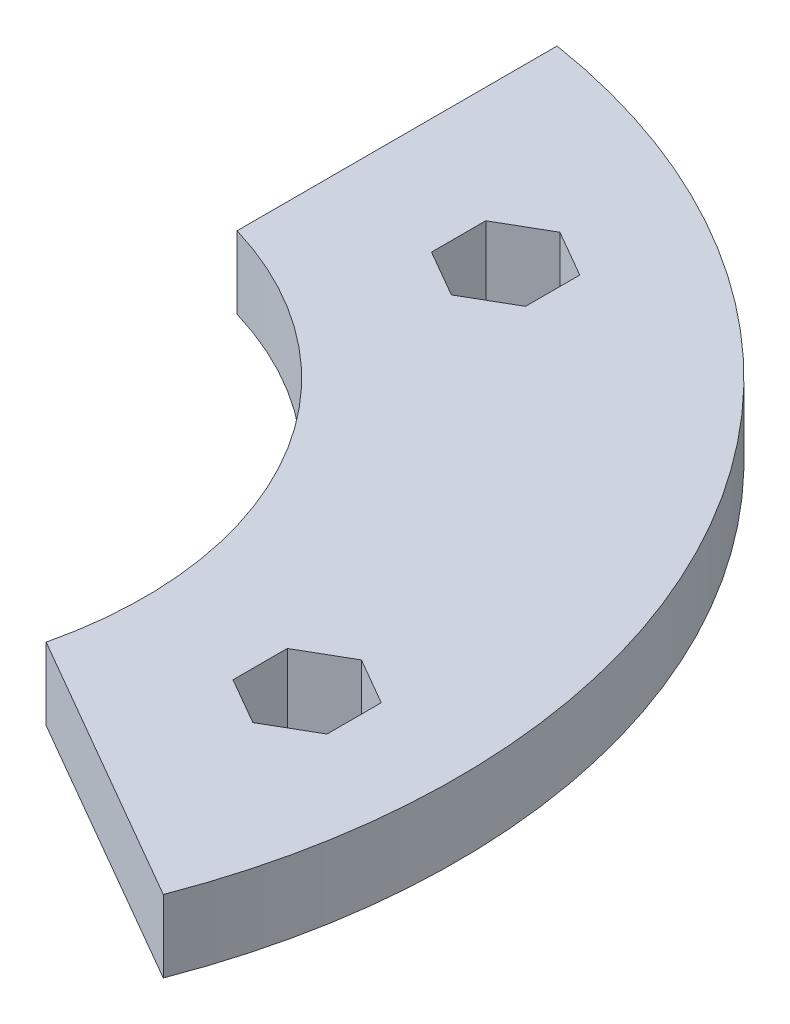
from build123d import *

# Parameters (mm, degrees)
SKETCH1_R           = 38.3
SKETCH1_R_2         = 21
BOSS_EXTRUDE1_DEPTH = 4
CUT_EXTRUDE1_DEPTH  = 10


with BuildPart() as part:
    # Sketch1 → Boss-Extrude1 (new body)
    with BuildSketch(Plane(origin=(0, 0, 0), x_dir=(1, 0, 0), z_dir=(0, 1, 0))):
        with Locations(Location((0, 0, 0), (0, 0, 270))):
            Circle(SKETCH1_R)
        with Locations(Location((0, 0, 0), (0, 0, 270))):
            Circle(SKETCH1_R_2, mode=Mode.SUBTRACT)
        Polygon((12.4, -27.481872813), (15, -28.982983513), (17.6, -27.481872813), (17.6, -24.479651414), (15, -22.978540714), (12.4, -24.479651414), align=None, mode=Mode.SUBTRACT)
        Polygon((30, 3.0022214), (27.4, 1.5011107), (27.4, -1.5011107), (30, -3.0022214), (32.6, -1.5011107), (32.6, 1.5011107), align=None, mode=Mode.SUBTRACT)
        Polygon((-17.6, -24.479651414), (-17.6, -27.481872813), (-15, -28.982983513), (-12.4, -27.481872813), (-12.4, -24.479651414), (-15, -22.978540714), align=None, mode=Mode.SUBTRACT)
        Polygon((-30, 3.0022214), (-32.6, 1.5011107), (-32.6, -1.5011107), (-30, -3.0022214), (-27.4, -1.5011107), (-27.4, 1.5011107), align=None, mode=Mode.SUBTRACT)
        Polygon((-12.4, 27.481872813), (-15, 28.982983513), (-17.6, 27.481872813), (-17.6, 24.479651414), (-15, 22.978540714), (-12.4, 24.479651414), align=None, mode=Mode.SUBTRACT)
        Polygon((17.6, 24.479651414), (17.6, 27.481872813), (15, 28.982983513), (12.4, 27.481872813), (12.4, 24.479651414), (15, 22.978540714), align=None, mode=Mode.SUBTRACT)
    extrude(amount=BOSS_EXTRUDE1_DEPTH)

    # Sketch2 → Cut-Extrude1 (cut)
    with BuildSketch(Plane(origin=(0, 4, 0), x_dir=(1, 0, 0), z_dir=(0, 1, 0))):
        with BuildLine():
            Line((6, 50.276302336), (6, 14.297506921))
            ThreePointArc((6, 14.297506921), (13.428105902, 7.752720557), (15.382004204, -1.952601038))
            Line((15.382004204, -1.952601038), (46.540555031, -19.941998745))
            ThreePointArc((46.540555031, -19.941998745), (-43.84951462, -25.31652907), (6, 50.276302336))
        make_face()
    extrude(amount=-CUT_EXTRUDE1_DEPTH, mode=Mode.SUBTRACT)


solid = part.part
